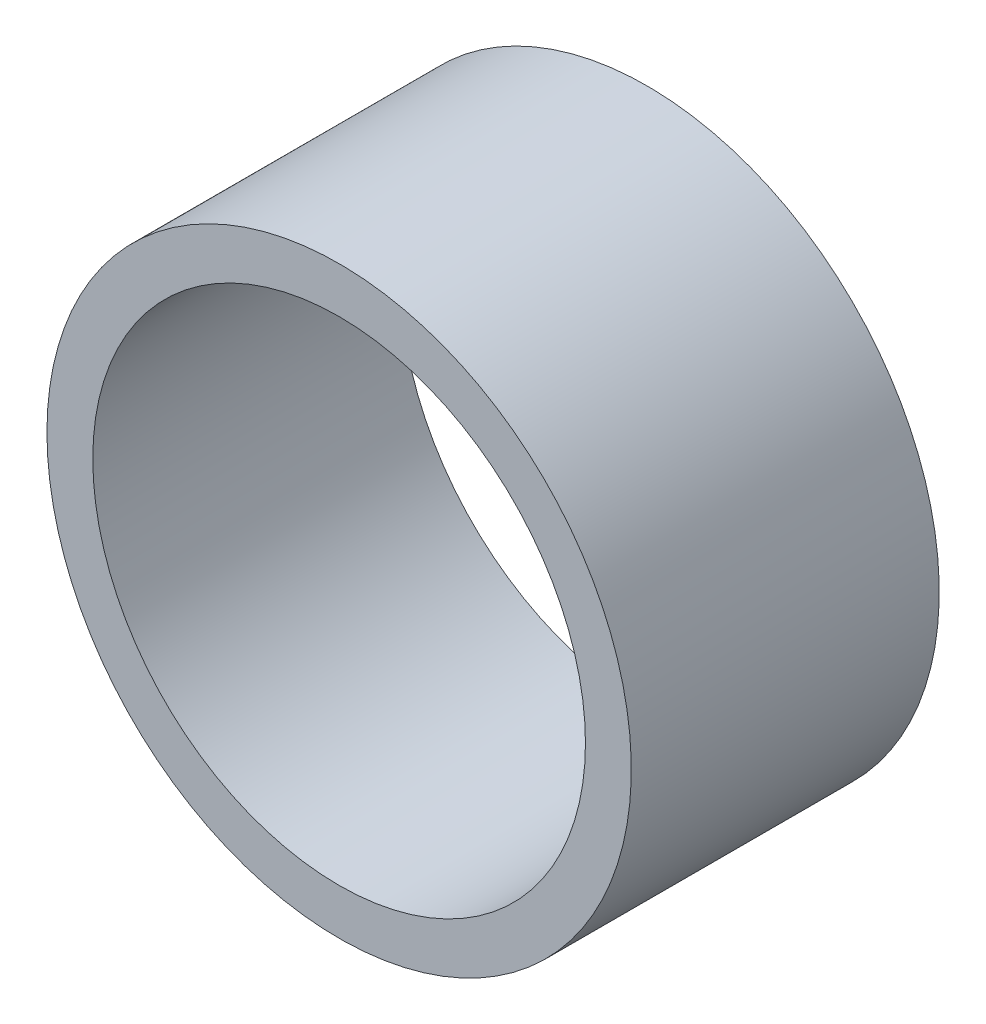
from build123d import *

# Parameters (mm, degrees)
SKETCH1_W = 22
SKETCH1_H = 3.275


with BuildPart() as part:
    # Sketch1 → Revolve1 (revolve)
    with BuildSketch(Plane(origin=(0, 0, 0), x_dir=(0, 0, -1), z_dir=(1, 0, 0)), mode=Mode.PRIVATE) as revolve1_sk:
        with Locations((-11, 19.2375)):
            Rectangle(SKETCH1_W, SKETCH1_H)
    revolve(revolve1_sk.sketch.rotate(Axis((0, 0, 0), (0, 0, 1)), 90), axis=Axis((0, 0, 0), (0, 0, 1)))


solid = part.part
